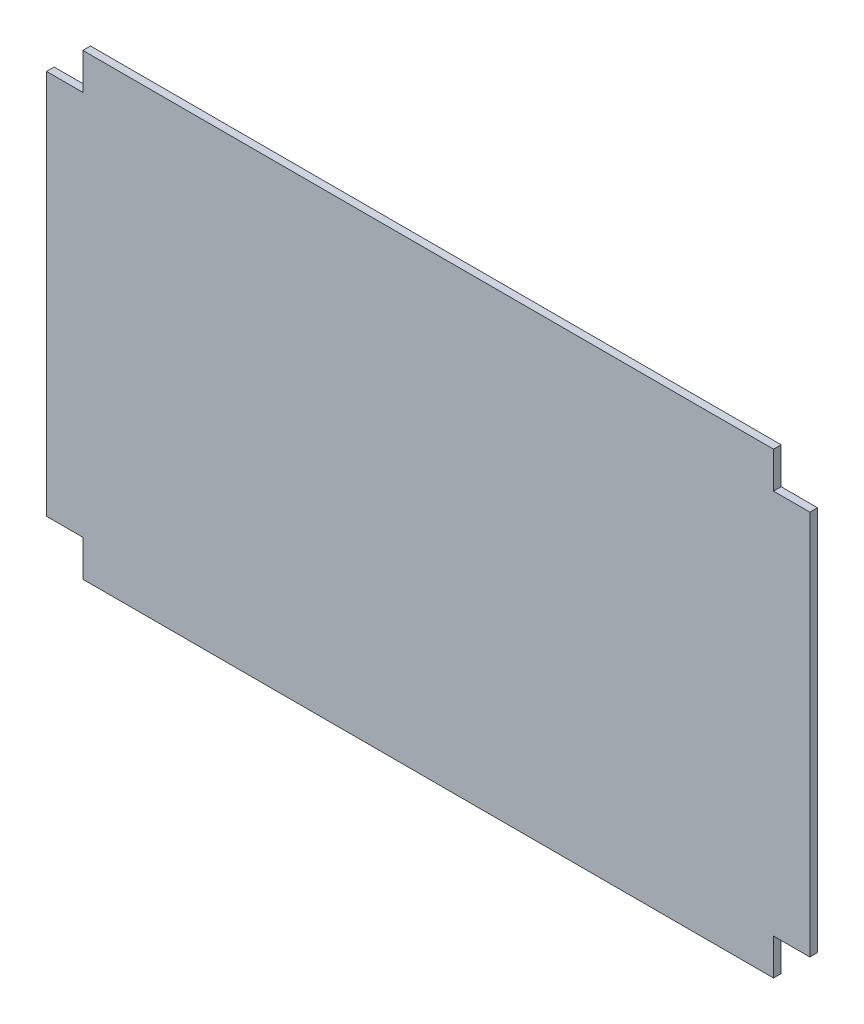
from build123d import *

# Parameters (mm, degrees)
SKETCH1_W           = 1270
SKETCH1_H           = 762
BOSS_EXTRUDE1_DEPTH = 12.7
SKETCH2_W           = 60.5
SKETCH2_H           = 60.5
CUT_EXTRUDE1_DEPTH  = 741.639784241


with BuildPart() as part:
    # Sketch1 → Boss-Extrude1 (new body)
    with BuildSketch(Plane.XY):
        Rectangle(SKETCH1_W, SKETCH1_H)
    extrude(amount=BOSS_EXTRUDE1_DEPTH)

    # Sketch2 → Cut-Extrude1 (cut, through all)
    with BuildSketch(Plane.XY.offset(12.7)):
        with Locations((-604.75, 350.75)):
            Rectangle(SKETCH2_W, SKETCH2_H)
        with Locations((604.75, 350.75)):
            Rectangle(SKETCH2_W, SKETCH2_H)
        with Locations((604.75, -350.75)):
            Rectangle(SKETCH2_W, SKETCH2_H)
        with Locations((-604.75, -350.75)):
            Rectangle(SKETCH2_W, SKETCH2_H)
    extrude(amount=-CUT_EXTRUDE1_DEPTH, mode=Mode.SUBTRACT)


solid = part.part
